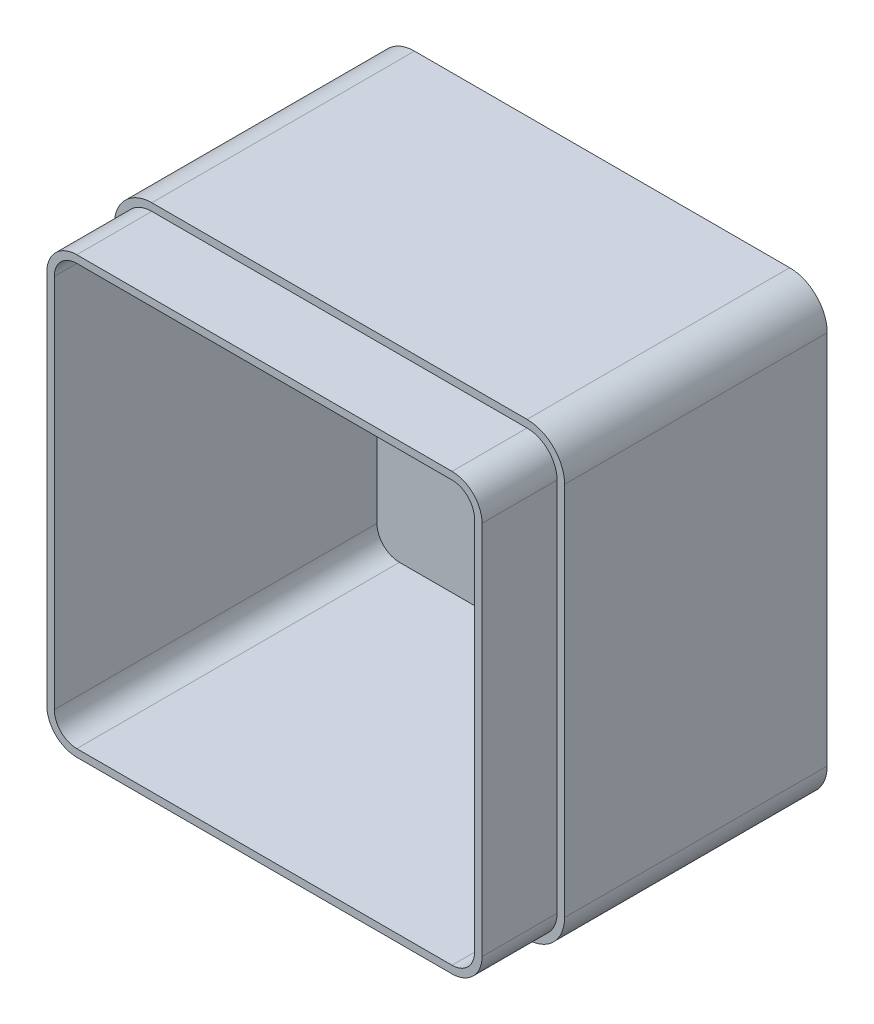
from build123d import *

# Parameters (mm, degrees)
SKETCH2_W           = 120
SKETCH2_H           = 120
BOSS_EXTRUDE1_DEPTH = 90
FILLET1_R           = 10
SHELL1_T            = -4
CUT_EXTRUDE2_DEPTH  = 20


with BuildPart() as part:
    # Sketch2 → Boss-Extrude1 (new body)
    with BuildSketch(Plane.XY):
        with Locations((60, 60)):
            Rectangle(SKETCH2_W, SKETCH2_H)
    extrude(amount=BOSS_EXTRUDE1_DEPTH)

    # Fillet1
    fillet1_edges = [part.edges().sort_by_distance(p)[0] for p in [
        (0, 120, 45),
        (120, 120, 45),
        (120, 0, 45),
        (0, 0, 45),
    ]]
    fillet(fillet1_edges, radius=FILLET1_R)

    # Shell1
    shell1_openings = [part.faces().sort_by_distance(p)[0] for p in [
        (60, 60, 90),
    ]]
    offset(amount=SHELL1_T, openings=shell1_openings, kind=Kind.INTERSECTION)

    # Sketch4 → Cut-Extrude2 (cut)
    with BuildSketch(Plane.XY.offset(90)):
        with BuildLine():
            Line((0, 110), (0, 10))
            ThreePointArc((0, 10), (2.928932188, 2.928932188), (10, 0))
            Line((10, 0), (110, 0))
            ThreePointArc((110, 0), (117.071067812, 2.928932188), (120, 10))
            Line((120, 10), (120, 110))
            ThreePointArc((120, 110), (117.071067812, 117.071067812), (110, 120))
            Line((110, 120), (10, 120))
            ThreePointArc((10, 120), (2.928932188, 117.071067812), (0, 110))
        make_face()
        with BuildLine():
            Line((2, 110), (2, 10))
            ThreePointArc((2, 10), (4.343145751, 4.343145751), (10, 2))
            Line((10, 2), (110, 2))
            ThreePointArc((110, 2), (115.656854249, 4.343145751), (118, 10))
            Line((118, 10), (118, 110))
            ThreePointArc((118, 110), (115.656854249, 115.656854249), (110, 118))
            Line((110, 118), (10, 118))
            ThreePointArc((10, 118), (4.343145751, 115.656854249), (2, 110))
        make_face(mode=Mode.SUBTRACT)
    extrude(amount=-CUT_EXTRUDE2_DEPTH, mode=Mode.SUBTRACT)


solid = part.part
